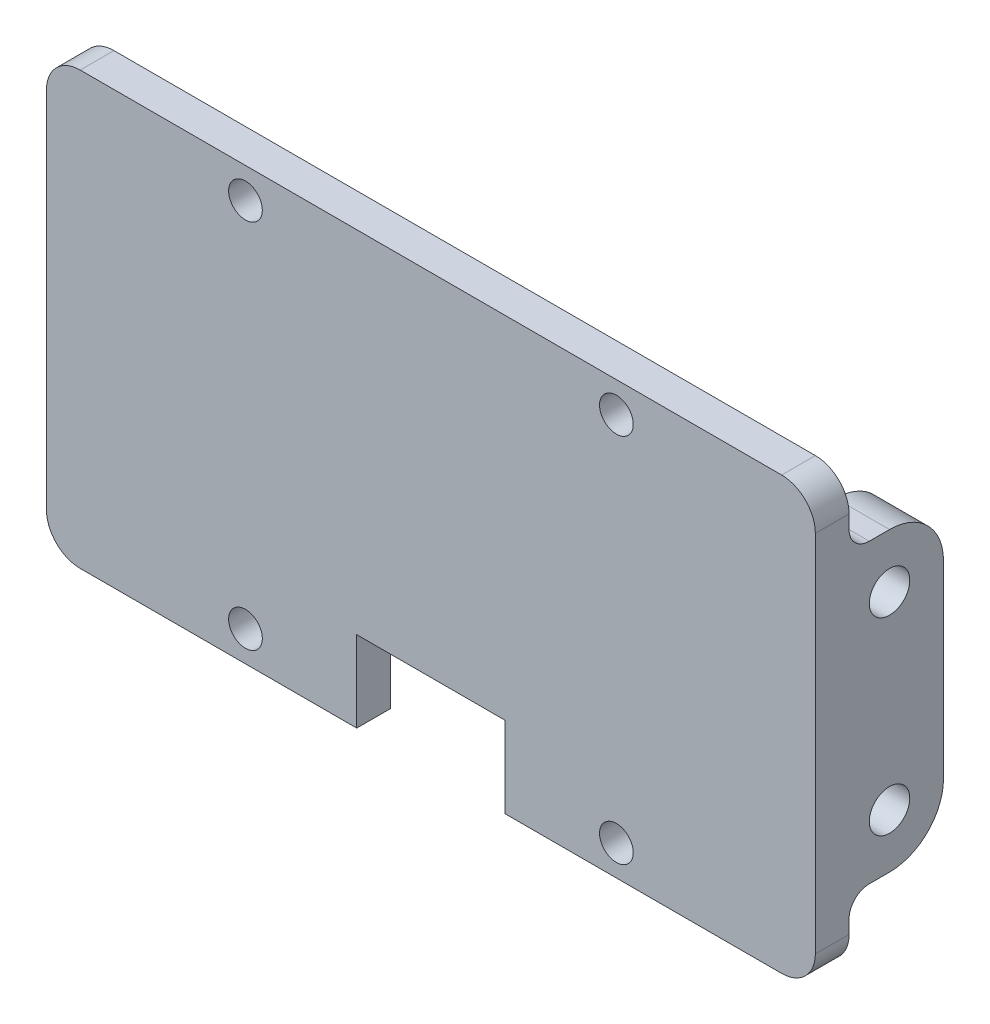
from build123d import *

# Parameters (mm, degrees)
SKETCH_1_R         = 1.25
EXTRUDE_1_DEPTH    = 2.5
SKETCH_3_R         = 1.5
EXTRUDE_2_DEPTH    = 4
EXTRUDE_START      = -4
SKETCH_4_R         = 1.5
EXTRUDE_3_DEPTH    = 4
FILLET_2_R         = 2.5
FILLET_3_R         = 1.5
GUSSET_1_THICKNESS = 5
GUSSET_2_THICKNESS = 5


with BuildPart() as part:
    # 草图1 → 凸台-拉伸1 (new body)
    with BuildSketch(Plane.XY):
        Polygon((-28.5, -16), (-16, -16), (-5.5, -16), (-5.5, -10), (0, -10), (5.5, -10), (5.5, -16), (16, -16), (28.5, -16), (28.5, 16), (16, 16), (-16, 16), (-28.5, 16), align=None)
        with Locations((-13.75, -13.75)):
            Circle(SKETCH_1_R, mode=Mode.SUBTRACT)
        with Locations((13.75, -13.75)):
            Circle(SKETCH_1_R, mode=Mode.SUBTRACT)
        with Locations((-13.75, 13.75)):
            Circle(SKETCH_1_R, mode=Mode.SUBTRACT)
        with Locations((13.75, 13.75)):
            Circle(SKETCH_1_R, mode=Mode.SUBTRACT)
    extrude(amount=EXTRUDE_1_DEPTH)

    # 草图3 → 凸台-拉伸2 (add)
    with BuildSketch(Plane.ZY.offset(28.5)):
        with BuildLine():
            Line((-3, 11), (0, 11))
            Line((0, 11), (0, -11))
            Line((0, -11), (-3, -11))
            ThreePointArc((-3, -11), (-5.828427125, -9.828427125), (-7, -7))
            Line((-7, -7), (-7, 7))
            ThreePointArc((-7, 7), (-5.828427125, 9.828427125), (-3, 11))
        make_face()
        with Locations((-3, 7)):
            Circle(SKETCH_3_R, mode=Mode.SUBTRACT)
        with Locations((-3, -7)):
            Circle(SKETCH_3_R, mode=Mode.SUBTRACT)
    extrude(amount=-EXTRUDE_2_DEPTH)

    # 草图4 → 凸台-拉伸3 (add)
    with BuildSketch(Plane(origin=(28.5, 0, 0), x_dir=(0, 0, -1), z_dir=(1, 0, 0)).offset(EXTRUDE_START)):
        with BuildLine():
            Line((7, -7), (7, 7))
            ThreePointArc((7, 7), (5.828427125, 9.828427125), (3, 11))
            Line((3, 11), (0, 11))
            Line((0, 11), (0, -11))
            Line((0, -11), (3, -11))
            ThreePointArc((3, -11), (5.828427125, -9.828427125), (7, -7))
        make_face()
        with Locations(Location((3, 7, 0), (0, 0, 180))):
            Circle(SKETCH_4_R, mode=Mode.SUBTRACT)
        with Locations(Location((3, -7, 0), (0, 0, 180))):
            Circle(SKETCH_4_R, mode=Mode.SUBTRACT)
    extrude(amount=EXTRUDE_3_DEPTH)

    # 圆角2
    fillet_2_edges = [part.edges().sort_by_distance(p)[0] for p in [
        (-28.5, -16, 1.25),
        (-28.5, 16, 1.25),
        (28.5, 16, 1.25),
        (28.5, -16, 1.25),
    ]]
    fillet(fillet_2_edges, radius=FILLET_2_R)

    # 圆角3
    fillet_3_edges = [part.edges().sort_by_distance(p)[0] for p in [
        (-26.5, 11, 0),
        (-26.5, -11, 0),
        (26.5, -11, 0),
        (26.5, 11, 0),
    ]]
    fillet(fillet_3_edges, radius=FILLET_3_R)


with BuildPart() as body_2:
    # Gusset 1: a gusset: a plate 5.0 thick in the corner of two members, its outline drawn in place
    gusset_1_outline = Wire([Line((24.5, 2.5, 0), (24.5, 2.5, -7)), Line((24.5, 2.5, -7), (17.5, 2.5, 0)), Line((17.5, 2.5, 0), (24.5, 2.5, 0))])
    add(extrude(Face(gusset_1_outline), amount=GUSSET_1_THICKNESS, dir=(0, -1, 0)))


with BuildPart() as body_3:
    # Gusset 2: a gusset: a plate 5.0 thick in the corner of two members, its outline drawn in place
    gusset_2_outline = Wire([Line((-24.5, 2.5, 0), (-17.5, 2.5, 0)), Line((-17.5, 2.5, 0), (-24.5, 2.5, -7)), Line((-24.5, 2.5, -7), (-24.5, 2.5, 0))])
    add(extrude(Face(gusset_2_outline), amount=GUSSET_2_THICKNESS, dir=(0, -1, 0)))


solid = Compound([part.part, body_2.part, body_3.part])
